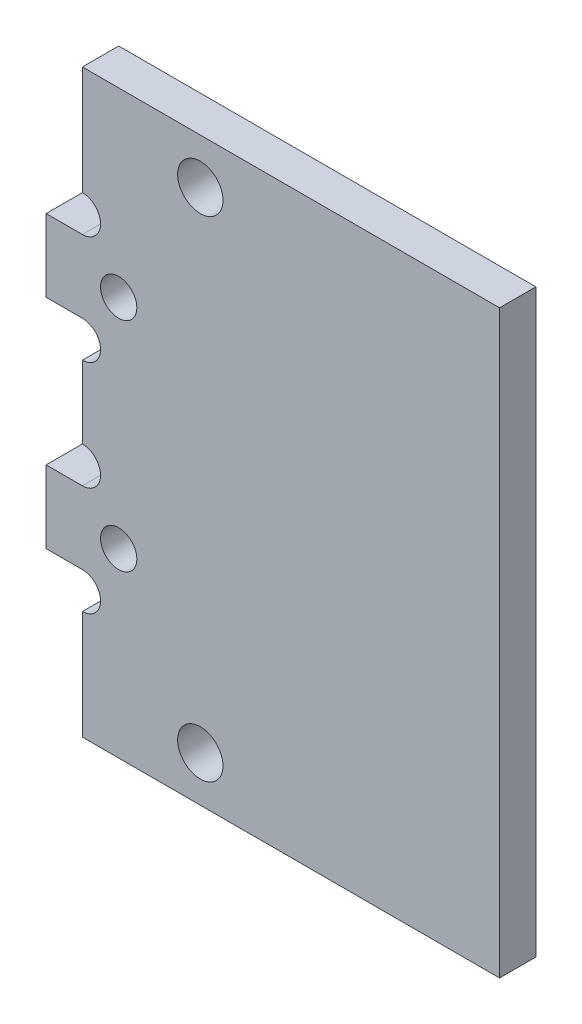
from build123d import *

# Parameters (mm, degrees)
SKETCH_1_R          = 1.25
SKETCH_1_R_2        = 1
EXTRUDE_1_DEPTH     = 2
SKETCH_4_W          = 16
SKETCH_4_H          = 22
CUT_EXTRUDE_1_DEPTH = 2
FILLET_2_R          = 2.5
FILLET_3_R          = 5
SKETCH_6_W          = 16
SKETCH_6_H          = 32
CUT_EXTRUDE_3_DEPTH = 10


with BuildPart() as part:
    # 草圖1 → 填料-伸長1 (new body)
    with BuildSketch(Plane.XY):
        with BuildLine():
            Line((-17.216213198, 10.1625), (13.283786802, 10.1625))
            Line((13.283786802, 10.1625), (13.283786802, -21.8375))
            Line((13.283786802, -21.8375), (-17.216213198, -21.8375))
            Line((-17.216213198, -21.8375), (-19.716213198, -21.8375))
            Line((-19.716213198, -21.8375), (-25.716213198, -21.8375))
            Line((-25.716213198, -21.8375), (-25.716213198, -15.8375))
            ThreePointArc((-25.716213198, -15.8375), (-24.716213198, -14.8375), (-25.716213198, -13.8375))
            Line((-25.716213198, -13.8375), (-27.716213198, -13.8375))
            Line((-27.716213198, -13.8375), (-27.716213198, -9.8375))
            Line((-27.716213198, -9.8375), (-25.716213198, -9.8375))
            ThreePointArc((-25.716213198, -9.8375), (-24.716213198, -8.8375), (-25.716213198, -7.8375))
            Line((-25.716213198, -7.8375), (-25.716213198, -3.8375))
            ThreePointArc((-25.716213198, -3.8375), (-24.716213198, -2.8375), (-25.716213198, -1.8375))
            Line((-25.716213198, -1.8375), (-27.716213198, -1.8375))
            Line((-27.716213198, -1.8375), (-27.716213198, 2.1625))
            Line((-27.716213198, 2.1625), (-25.716213198, 2.1625))
            ThreePointArc((-25.716213198, 2.1625), (-24.716213198, 3.1625), (-25.716213198, 4.1625))
            Line((-25.716213198, 4.1625), (-25.716213198, 10.1625))
            Line((-25.716213198, 10.1625), (-21.716213198, 10.1625))
            Line((-21.716213198, 10.1625), (-17.216213198, 10.1625))
        make_face()
        with Locations((-19.216213198, 7.6625)):
            Circle(SKETCH_1_R, mode=Mode.SUBTRACT)
        with Locations((-19.216213198, -19.3375)):
            Circle(SKETCH_1_R, mode=Mode.SUBTRACT)
        with Locations((10.783786802, -19.3375)):
            Circle(SKETCH_1_R, mode=Mode.SUBTRACT)
        with Locations((10.783786802, 7.6625)):
            Circle(SKETCH_1_R, mode=Mode.SUBTRACT)
        with Locations((-23.716213198, 0.1625)):
            Circle(SKETCH_1_R_2, mode=Mode.SUBTRACT)
        with Locations((-23.716213198, -11.8375)):
            Circle(SKETCH_1_R_2, mode=Mode.SUBTRACT)
    extrude(amount=EXTRUDE_1_DEPTH)

    # 草圖4 → 除料-伸長1 (cut)
    with BuildSketch(Plane(origin=(0, 0, 0), x_dir=(-1, 0, 0), z_dir=(0, 0, -1))):
        with Locations((-5.283786802, -5.8375)):
            Rectangle(SKETCH_4_W, SKETCH_4_H)
    extrude(amount=-CUT_EXTRUDE_1_DEPTH, mode=Mode.SUBTRACT)

    # 圓角2
    fillet_2_edges = [part.edges().sort_by_distance(p)[0] for p in [
        (13.283786802, -16.8375, 1),
        (13.283786802, 5.1625, 1),
    ]]
    fillet(fillet_2_edges, radius=FILLET_2_R)

    # 圓角3
    fillet_3_edges = [part.edges().sort_by_distance(p)[0] for p in [
        (-2.716213198, 5.1625, 1),
        (-2.716213198, -16.8375, 1),
    ]]
    fillet(fillet_3_edges, radius=FILLET_3_R)

    # 草圖6 → 除料-伸長3 (cut)
    with BuildSketch(Plane(origin=(0, 0, 0), x_dir=(-1, 0, 0), z_dir=(0, 0, -1))):
        with Locations((-5.283786802, -5.8375)):
            Rectangle(SKETCH_6_W, SKETCH_6_H)
    extrude(amount=-CUT_EXTRUDE_3_DEPTH, mode=Mode.SUBTRACT)


solid = part.part
